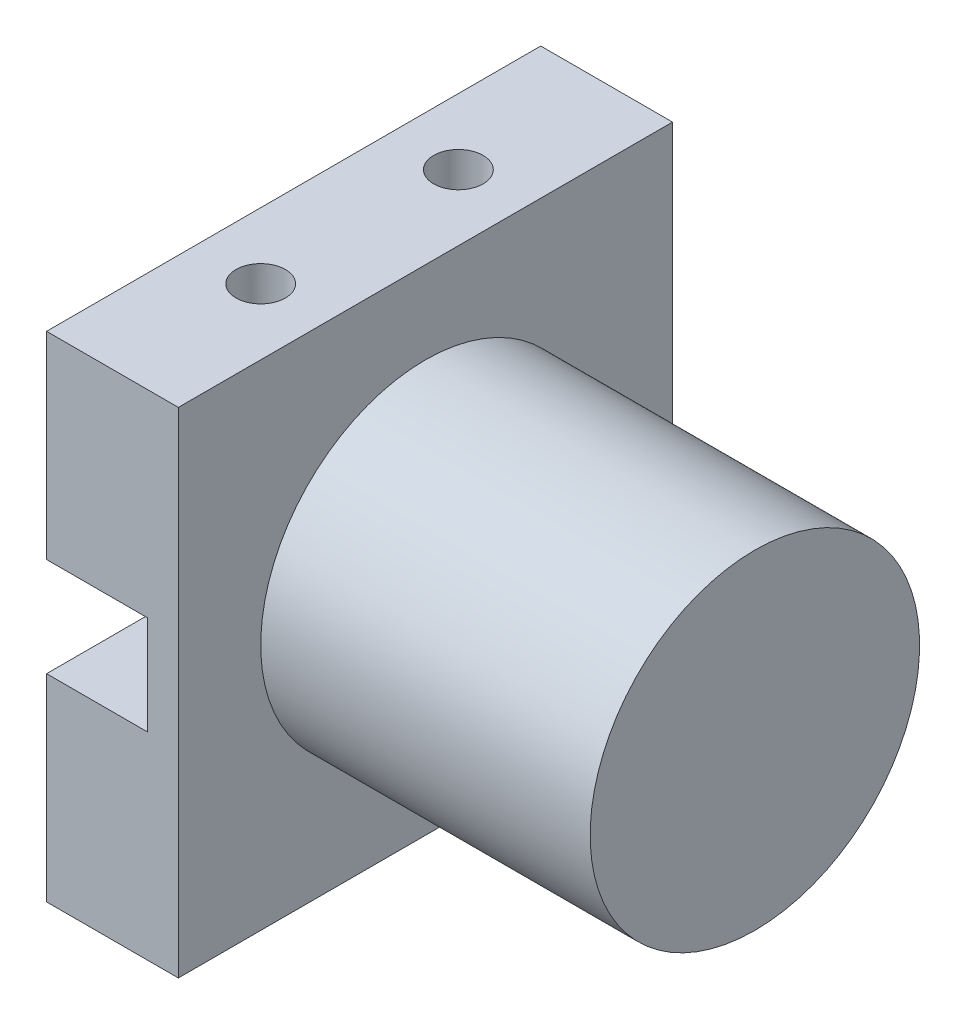
from build123d import *

# Parameters (mm, degrees)
BOSS_EXTRUDE1_DEPTH = 15
SKETCH2_R           = 1.5
CUT_EXTRUDE1_DEPTH  = 35.481879299
SKETCH3_R           = 10
BOSS_EXTRUDE2_DEPTH = 20


with BuildPart() as part:
    # Sketch1 → Boss-Extrude1 (new, symmetric)
    with BuildSketch(Plane.XY):
        Polygon((0, -15), (0, 15), (-8, 15), (-8, 3), (-1.885714286, 3), (-1.885714286, -3), (-8, -3), (-8, -15), align=None)
    extrude(amount=BOSS_EXTRUDE1_DEPTH, both=True)

    # Sketch2 → Cut-Extrude1 (cut, through all)
    with BuildSketch(Plane(origin=(0, 15, 0), x_dir=(1, 0, 0), z_dir=(0, 1, 0))):
        with Locations(Location((-4, 6, 0), (0, 0, 270))):
            Circle(SKETCH2_R)
        with Locations((-4, -6)):
            Circle(SKETCH2_R)
    extrude(amount=-CUT_EXTRUDE1_DEPTH, mode=Mode.SUBTRACT)

    # Sketch3 → Boss-Extrude2 (add)
    with BuildSketch(Plane(origin=(0, 0, 0), x_dir=(0, 0, -1), z_dir=(1, 0, 0))):
        with Locations(Location((0, 0, 0), (0, 0, 90))):
            Circle(SKETCH3_R)
    extrude(amount=BOSS_EXTRUDE2_DEPTH)


solid = part.part
